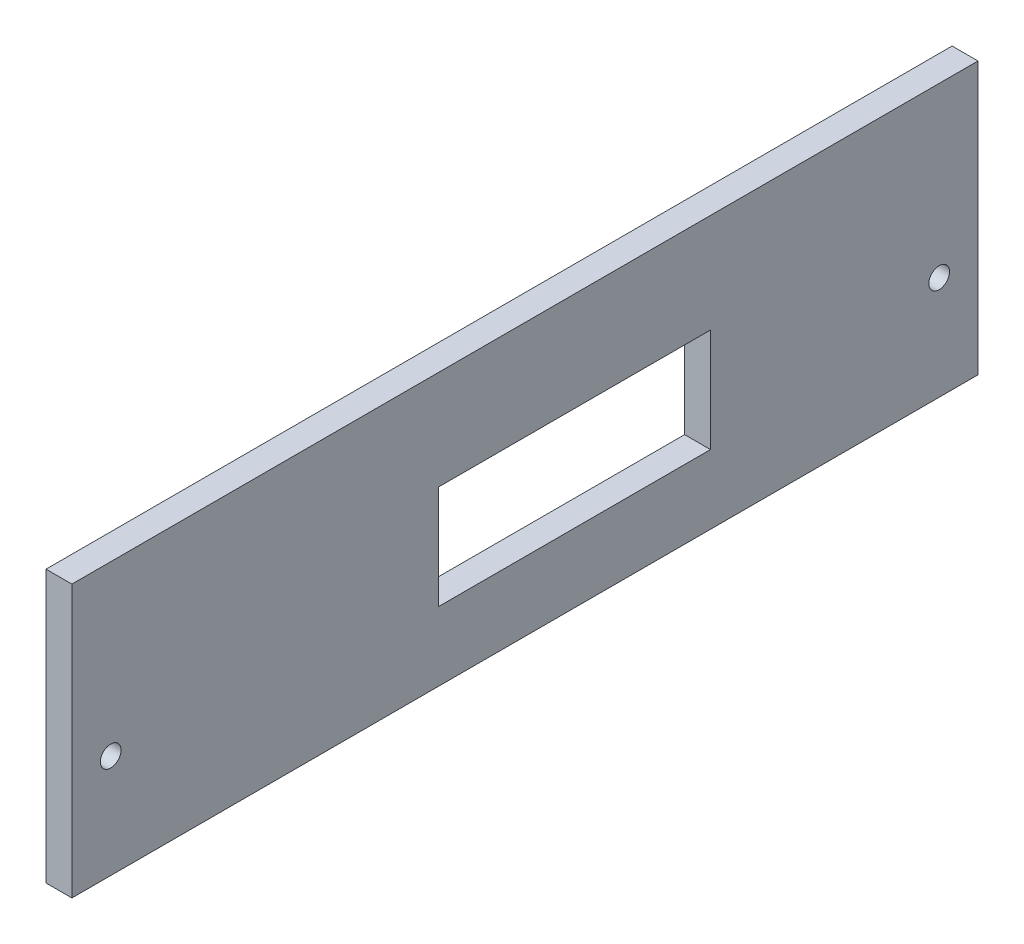
from build123d import *

# Parameters (mm, degrees)
SKETCH8_W            = 52.5
SKETCH8_H            = 15.75
SKETCH8_R            = 0.6
SKETCH8_W_2          = 15.75
SKETCH8_H_2          = 6
BOSS_EXTRUDE13_DEPTH = 1.5


with BuildPart() as part:
    # Sketch8 → Boss-Extrude13 (new body)
    with BuildSketch(Plane.ZY):
        with Locations((-25.5, 6.625)):
            Rectangle(SKETCH8_W, SKETCH8_H)
        with Locations((-49.5, 4.75)):
            Circle(SKETCH8_R, mode=Mode.SUBTRACT)
        with Locations((-1.5, 4.75)):
            Circle(SKETCH8_R, mode=Mode.SUBTRACT)
        with Locations((-28.375, 5.75)):
            Rectangle(SKETCH8_W_2, SKETCH8_H_2, mode=Mode.SUBTRACT)
    extrude(amount=BOSS_EXTRUDE13_DEPTH)


solid = part.part
